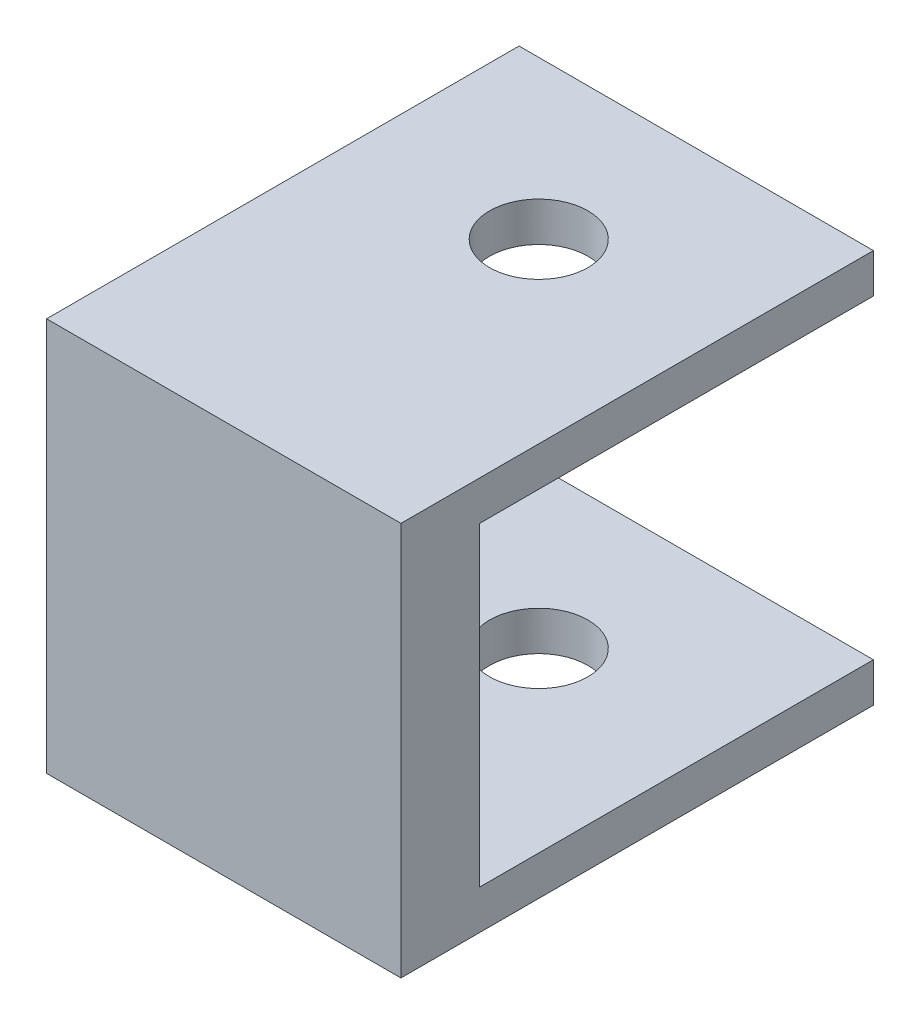
from build123d import *

# Parameters (mm, degrees)
EXTRUDE_1_DEPTH          = 18
CUT_EXTRUDE_1_DEPTH      = 37
CUT_EXTRUDE_1_DEPTH_BACK = 18
SKETCH_2_R               = 2.5


with BuildPart() as part:
    # 草图1 → 凸台-拉伸1 (new body)
    with BuildSketch(Plane(origin=(0, 0, 0), x_dir=(0, 0, -1), z_dir=(1, 0, 0))):
        Polygon((0, 20), (0, 0), (24, 0), (24, 2), (4, 2), (4, 18), (24, 18), (24, 20), align=None)
    extrude(amount=EXTRUDE_1_DEPTH)

    # 草图2 → 切除-拉伸1 (cut, two sides: drawn at the far end of the back side and taken through both)
    with BuildSketch(Plane(origin=(0, 2, 0), x_dir=(1, 0, 0), z_dir=(0, 1, 0)).offset(-CUT_EXTRUDE_1_DEPTH_BACK)):
        with Locations(Location((9, 16, 0), (0, 0, 90))):
            Circle(SKETCH_2_R)
    extrude(amount=CUT_EXTRUDE_1_DEPTH + CUT_EXTRUDE_1_DEPTH_BACK, mode=Mode.SUBTRACT)


solid = part.part
